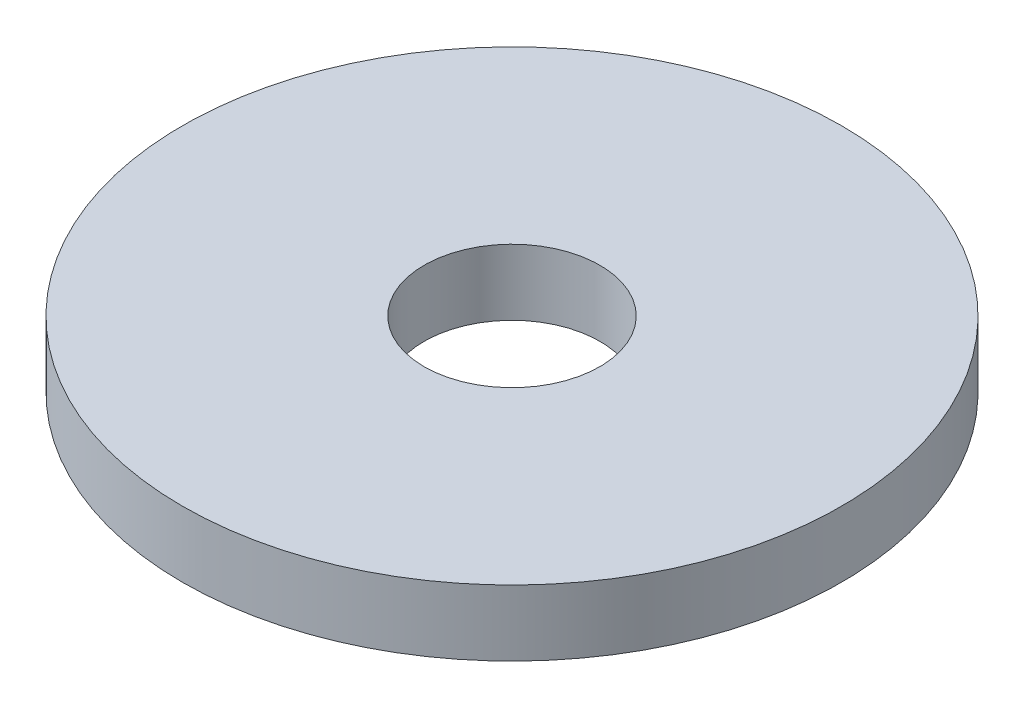
from build123d import *

# Parameters (mm, degrees)
CROQUIS1_W            = 15
CROQUIS1_H            = 3
CROQUIS5_R            = 4
CORTAR_EXTRUIR1_DEPTH = 10


with BuildPart() as part:
    # Croquis1 → Revolución3 (revolve)
    with BuildSketch(Plane.XY, mode=Mode.PRIVATE) as revoluci_n3_sk:
        with Locations((7.5, 1.5)):
            Rectangle(CROQUIS1_W, CROQUIS1_H)
    revolve(revoluci_n3_sk.sketch.rotate(Axis((0, 3, 0), (0, -1, 0)), 90), axis=Axis((0, 3, 0), (0, -1, 0)))

    # Croquis5 → Cortar-Extruir1 (cut)
    with BuildSketch(Plane(origin=(0, 3, 0), x_dir=(1, 0, 0), z_dir=(0, 1, 0))):
        with Locations(Location((0, 0, 0), (0, 0, 270))):
            Circle(CROQUIS5_R)
    extrude(amount=-CORTAR_EXTRUIR1_DEPTH, mode=Mode.SUBTRACT)


solid = part.part
